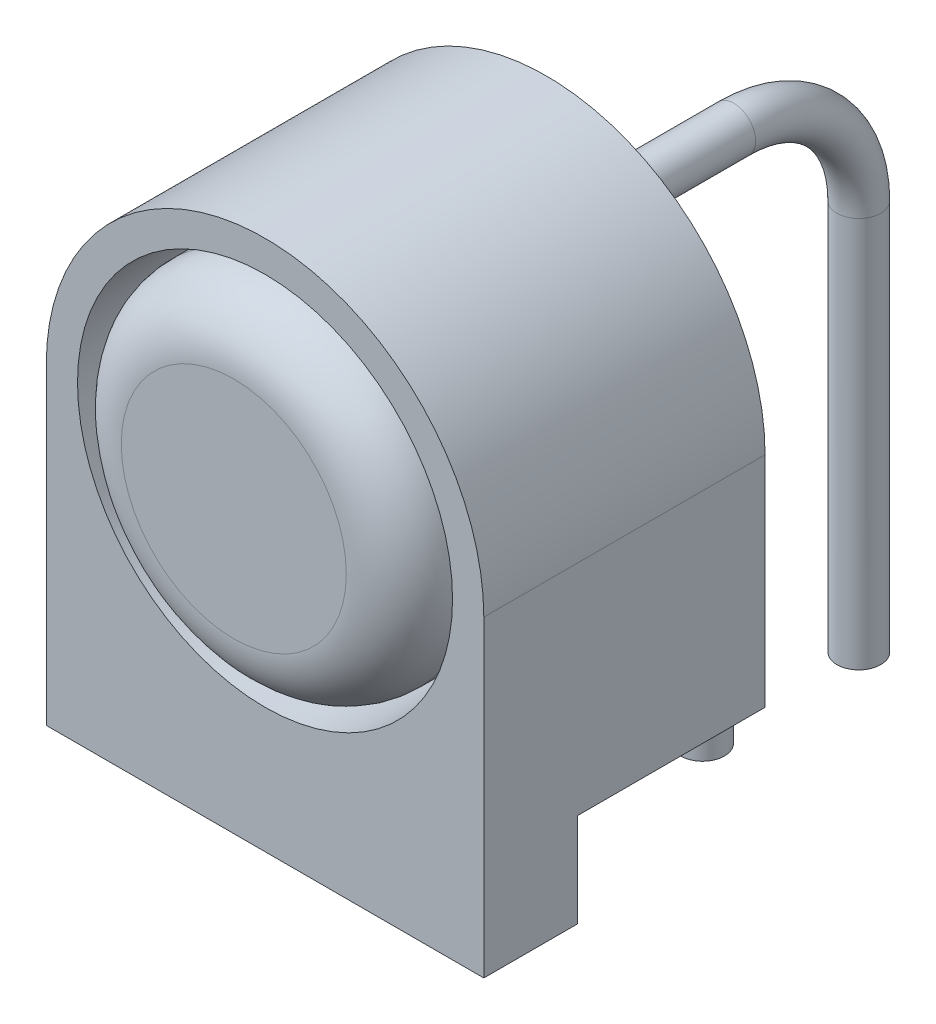
from build123d import *

# Parameters (mm, degrees)
EXTRUDE_2_DEPTH     = 4.5
SKETCH_2_R          = 3
CUT_EXTRUDE_1_DEPTH = 3.5
SKETCH_3_R          = 2.8
EXTRUDE_3_DEPTH     = 4
CUT_EXTRUDE_2_DEPTH = 1.5
SWEEP_2_PROFILE_R   = 0.35
SWEEP_3_PROFILE_R   = 0.35
FILLET_1_R          = 1


with BuildPart() as part:
    # Эскиз1 → Бобышка-Вытянуть2 (new body)
    with BuildSketch(Plane.XY):
        with BuildLine():
            Line((-3.5, -3.5), (-3.5, 0))
            ThreePointArc((-3.5, 0), (0, 3.5), (3.5, 0))
            Line((3.5, 0), (3.5, -3.5))
            Line((3.5, -3.5), (3.5, -5))
            Line((3.5, -5), (-3.5, -5))
            Line((-3.5, -5), (-3.5, -3.5))
        make_face()
    extrude(amount=EXTRUDE_2_DEPTH)

    # Эскиз2 → Вырез-Вытянуть1 (cut)
    with BuildSketch(Plane.XY.offset(4.5)):
        Circle(SKETCH_2_R)
    extrude(amount=-CUT_EXTRUDE_1_DEPTH, mode=Mode.SUBTRACT)

    # Эскиз3 → Бобышка-Вытянуть3 (add)
    with BuildSketch(Plane.XY.offset(1)):
        Circle(SKETCH_3_R)
    extrude(amount=EXTRUDE_3_DEPTH)

    # Эскиз4 → Вырез-Вытянуть2 (cut)
    with BuildSketch(Plane.XZ.offset(5)):
        Polygon((0.146156233, 3), (-3.5, 3), (-3.5, 0), (3.5, 0), (3.5, 3), align=None)
    extrude(amount=-CUT_EXTRUDE_2_DEPTH, mode=Mode.SUBTRACT)

    # По траектории2: sweep along a path in Эскиз6
    with BuildLine(Plane.ZY) as sweep_2_path:
        Line((0, -1.27), (-1.5, -1.27))
        ThreePointArc((-1.5, -1.27), (-2.207106781, -1.562893219), (-2.5, -2.27))
        Line((-2.5, -2.27), (-2.5, -5))
        Line((-2.5, -5), (-2.5, -7))
    # По траектории2 profile (on start of the path) → По траектории2 (sweep)
    with BuildSketch(Plane(origin=(0, -1.27, 0), x_dir=(-1, 0, 0), z_dir=(0, 0, -1))):
        Circle(SWEEP_2_PROFILE_R)
    sweep(path=sweep_2_path.line)

    # По траектории3: sweep along a path in Эскиз107
    with BuildLine(Plane.ZY) as sweep_3_path:
        Line((0, 1.27), (-3, 1.27))
        ThreePointArc((-3, 1.27), (-4.414213562, 0.684213562), (-5, -0.73))
        Line((-5, -0.73), (-5, -6.984666466))
    # По траектории3 profile (on start of the path) → По траектории3 (sweep)
    with BuildSketch(Plane(origin=(0, 1.27, 0), x_dir=(0, -1, 0), z_dir=(0, 0, -1))):
        Circle(SWEEP_3_PROFILE_R)
    sweep(path=sweep_3_path.line)

    # Скругление1
    fillet_1_edges = [part.edges().sort_by_distance(p)[0] for p in [
        (-2.8, 0, 5),
    ]]
    fillet(fillet_1_edges, radius=FILLET_1_R)


solid = part.part
